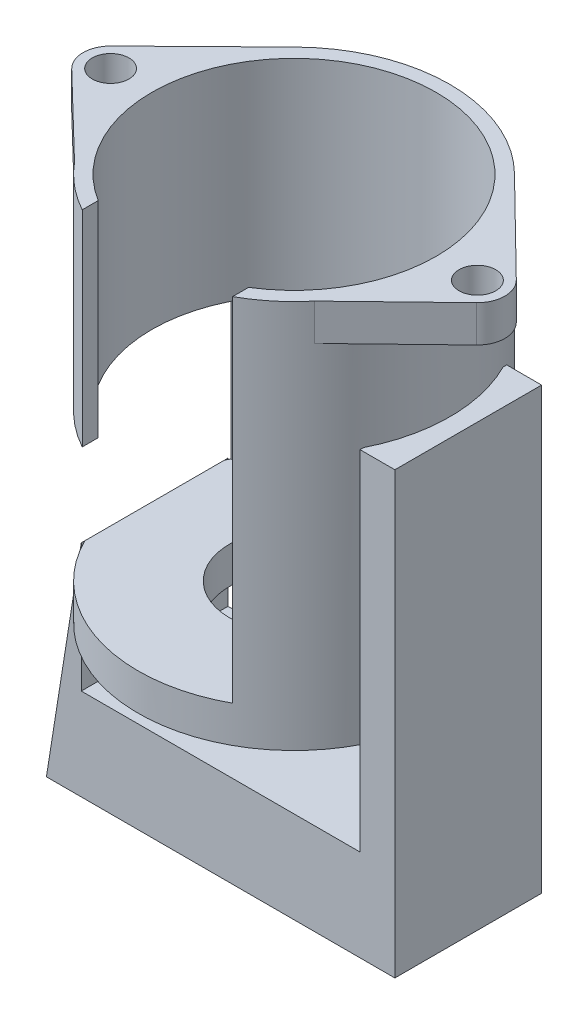
from build123d import *
from build123d.topology import SkipClean

# Parameters (mm, degrees)
SKETCH_2_W                = 19
SKETCH_2_H                = 8
EXTRUDE_1_DEPTH           = 9
SKETCH_4_R                = 8.5
EXTRUDE_2_DEPTH           = 22.2
CUT_EXTRUDE_5_REACH       = 27.6
SKETCH_5_2_R              = 7.75
EXTRUDE_START             = -2
SKETCH_9_R                = 1
EXTRUDE_4_DEPTH           = 2
SKETCH_5_R                = 7.75
CUT_EXTRUDE_8_DEPTH       = 27.407196
SKETCH_11_W               = 15.2
SKETCH_11_H               = 8
CUT_EXTRUDE_11_DEPTH      = 4
SKETCH_12_W               = 8.2
SKETCH_12_H               = 22.2
CUT_EXTRUDE_12_DEPTH      = 27.407196
SKETCH_13_W               = 11.493961
SKETCH_13_H               = 8
CUT_EXTRUDE_13_DEPTH      = 27.407196
EXTRUDE_6_DEPTH           = 3
EXTRUDE_7_DEPTH           = 15
SKETCH_16_R               = 1
CUT_EXTRUDE_14_DEPTH      = 30.848618
SKETCH_17_R               = 8.5
SKETCH_17_R_2             = 3.5
EXTRUDE_8_DEPTH           = 2
CUT_EXTRUDE_15_DEPTH      = 27.407196
CUT_EXTRUDE_15_DEPTH_BACK = 27.407196
CUT_EXTRUDE_17_DEPTH      = 1


with BuildPart() as part:
    # 草图2 → 凸台-拉伸1 (new body)
    with BuildSketch(Plane(origin=(0, 0, 0), x_dir=(1, 0, 0), z_dir=(0, 1, 0))):
        Rectangle(SKETCH_2_W, SKETCH_2_H)
    extrude(amount=-EXTRUDE_1_DEPTH)

    # 草图4 → 凸台-拉伸2 (add)
    with BuildSketch(Plane(origin=(0, 0, 0), x_dir=(1, 0, 0), z_dir=(0, 1, 0))):
        Circle(SKETCH_4_R)
    extrude(amount=EXTRUDE_2_DEPTH)

    # 草图5<2> → 切除-拉伸5 (cut, up to next)
    with BuildSketch(Plane(origin=(0, 0, 0), x_dir=(1, 0, 0), z_dir=(0, 1, 0)), mode=Mode.PRIVATE) as cut_extrude_5_sk1:
        Circle(SKETCH_5_2_R)
    cut_extrude_5_tool1 = extrude(cut_extrude_5_sk1.sketch, amount=CUT_EXTRUDE_5_REACH, mode=Mode.PRIVATE) & part.part
    add(cut_extrude_5_tool1.solids().sort_by_distance((0, 0, 0))[0], mode=Mode.SUBTRACT)

    # 草图9 → 凸台-拉伸4 (add)
    with SkipClean():  # the faces are left unmerged after this step: merging them gives an invalid solid
        with BuildSketch(Plane(origin=(0, 22.2, 0), x_dir=(1, 0, 0), z_dir=(0, 1, 0)).offset(EXTRUDE_START)):
            with BuildLine():
                Line((-11.05, 1.071214), (-5.95, 6.070214))
                ThreePointArc((-5.95, 6.070214), (0, 8.5), (5.95, 6.070214))
                Line((5.95, 6.070214), (11.05, 1.071214))
                ThreePointArc((11.05, 1.071214), (11.49999, -0.005522), (11.042085, -1.078916))
                Line((11.042085, -1.078916), (6.548688, -5.418919))
                ThreePointArc((6.548688, -5.418919), (0, -8.5), (-6.548688, -5.418919))
                Line((-6.548688, -5.418919), (-11.042085, -1.078916))
                ThreePointArc((-11.042085, -1.078916), (-11.49999, -0.005522), (-11.05, 1.071214))
            make_face()
            with Locations((-10, 0)):
                Circle(SKETCH_9_R, mode=Mode.SUBTRACT)
            with Locations((10, 0)):
                Circle(SKETCH_9_R, mode=Mode.SUBTRACT)
        extrude(amount=EXTRUDE_4_DEPTH)

    # 草图5 → 切除-拉伸8 (cut, through all)
    with SkipClean():  # the faces are left unmerged after this step: merging them gives an invalid solid
        with BuildSketch(Plane(origin=(0, 0, 0), x_dir=(1, 0, 0), z_dir=(0, 1, 0))):
            Circle(SKETCH_5_R)
        extrude(amount=CUT_EXTRUDE_8_DEPTH, mode=Mode.SUBTRACT)

    # 草图11 → 切除-拉伸11 (cut)
    with SkipClean():  # the faces are left unmerged after this step: merging them gives an invalid solid
        with BuildSketch(Plane(origin=(0, 0, 0), x_dir=(1, 0, 0), z_dir=(0, 1, 0))):
            Rectangle(SKETCH_11_W, SKETCH_11_H)
        extrude(amount=-CUT_EXTRUDE_11_DEPTH, mode=Mode.SUBTRACT)

    # 草图12 → 切除-拉伸12 (cut, through all)
    with SkipClean():  # the faces are left unmerged after this step: merging them gives an invalid solid
        with BuildSketch(Plane.XY):
            with Locations((0, 11.1)):
                Rectangle(SKETCH_12_W, SKETCH_12_H)
        extrude(amount=CUT_EXTRUDE_12_DEPTH, mode=Mode.SUBTRACT)

    # 草图13 → 切除-拉伸13 (cut, through all)
    with SkipClean():  # the faces are left unmerged after this step: merging them gives an invalid solid
        with BuildSketch(Plane(origin=(0, 0, 0), x_dir=(0, 0, -1), z_dir=(1, 0, 0))):
            with Locations((-1.698824, 7)):
                Rectangle(SKETCH_13_W, SKETCH_13_H)
        extrude(amount=-CUT_EXTRUDE_13_DEPTH, mode=Mode.SUBTRACT)

    # 草图14 → 凸台-拉伸6 (add)
    with BuildSketch(Plane(origin=(0, 0, 0), x_dir=(1, 0, 0), z_dir=(0, 1, 0))):
        with BuildLine():
            Line((-7.6, 3.806573), (-7.6, 4))
            Line((-7.6, 4), (-9.5, 4))
            Line((-9.5, 4), (-9.5, -4))
            Line((-9.5, -4), (-7.6, -4))
            Line((-7.6, -4), (-7.6, -3.806573))
            ThreePointArc((-7.6, -3.806573), (-8.5, 0), (-7.6, 3.806573))
        make_face()
    extrude(amount=EXTRUDE_6_DEPTH)

    # 草图15 → 凸台-拉伸7 (add)
    with SkipClean():  # the faces are left unmerged after this step: merging them gives an invalid solid
        with BuildSketch(Plane(origin=(0, 0, 0), x_dir=(1, 0, 0), z_dir=(0, 1, 0))):
            with BuildLine():
                Line((7.6, -3.806573), (7.6, -4))
                Line((7.6, -4), (9.5, -4))
                Line((9.5, -4), (9.5, 4))
                Line((9.5, 4), (7.6, 4))
                Line((7.6, 4), (7.6, 3.806573))
                ThreePointArc((7.6, 3.806573), (8.5, 0), (7.6, -3.806573))
            make_face()
        extrude(amount=EXTRUDE_7_DEPTH)

    # 草图16 → 切除-拉伸14 (cut, through all)
    with SkipClean():  # the faces are left unmerged after this step: merging them gives an invalid solid
        with BuildSketch(Plane(origin=(0, -4, 0), x_dir=(1, 0, 0), z_dir=(0, 1, 0))):
            with Locations((-6, 0)):
                Circle(SKETCH_16_R)
            with Locations((6, 0)):
                Circle(SKETCH_16_R)
        extrude(amount=-CUT_EXTRUDE_14_DEPTH, mode=Mode.SUBTRACT)

    # 草图17 → 凸台-拉伸8 (add)
    with BuildSketch(Plane(origin=(0, 3, 0), x_dir=(1, 0, 0), z_dir=(0, 1, 0)).offset(EXTRUDE_START)):
        Circle(SKETCH_17_R)
        Circle(SKETCH_17_R_2, mode=Mode.SUBTRACT)
    extrude(amount=EXTRUDE_8_DEPTH)

    # 草图18 → 切除-拉伸15 (cut, two sides: drawn at the far end of the back side and taken through both)
    with BuildSketch(Plane.XY.offset(-CUT_EXTRUDE_15_DEPTH_BACK)):
        Polygon((-7.6, 3), (-9.5, -9), (-9.5, 3), align=None)
    extrude(amount=CUT_EXTRUDE_15_DEPTH + CUT_EXTRUDE_15_DEPTH_BACK, mode=Mode.SUBTRACT)

    # 草图19 → 切除-拉伸17 (cut)
    with BuildSketch(Plane(origin=(0, 0, 0), x_dir=(1, 0, 0), z_dir=(0, 1, 0))):
        with BuildLine():
            Line((-7.5, -4), (-7.5, 4))
            ThreePointArc((-7.5, 4), (8.5, 0), (-7.5, -4))
        make_face()
    extrude(amount=CUT_EXTRUDE_17_DEPTH, mode=Mode.SUBTRACT)


solid = part.part
